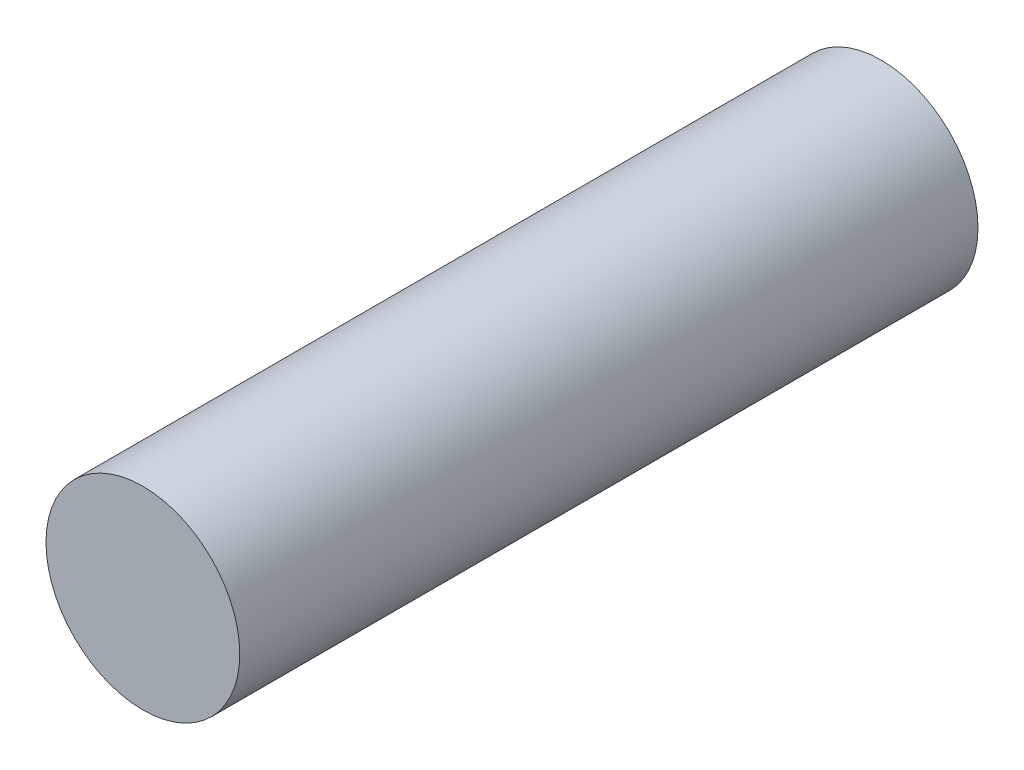
from build123d import *

# Parameters (mm, degrees)
SKETCH1_R           = 5
BOSS_EXTRUDE1_DEPTH = 38.1


with BuildPart() as part:
    # Sketch1 → Boss-Extrude1 (new body)
    with BuildSketch(Plane.XY):
        with Locations(Location((0, 0, 0), (0, 0, 180))):
            Circle(SKETCH1_R)
    extrude(amount=BOSS_EXTRUDE1_DEPTH)


solid = part.part
